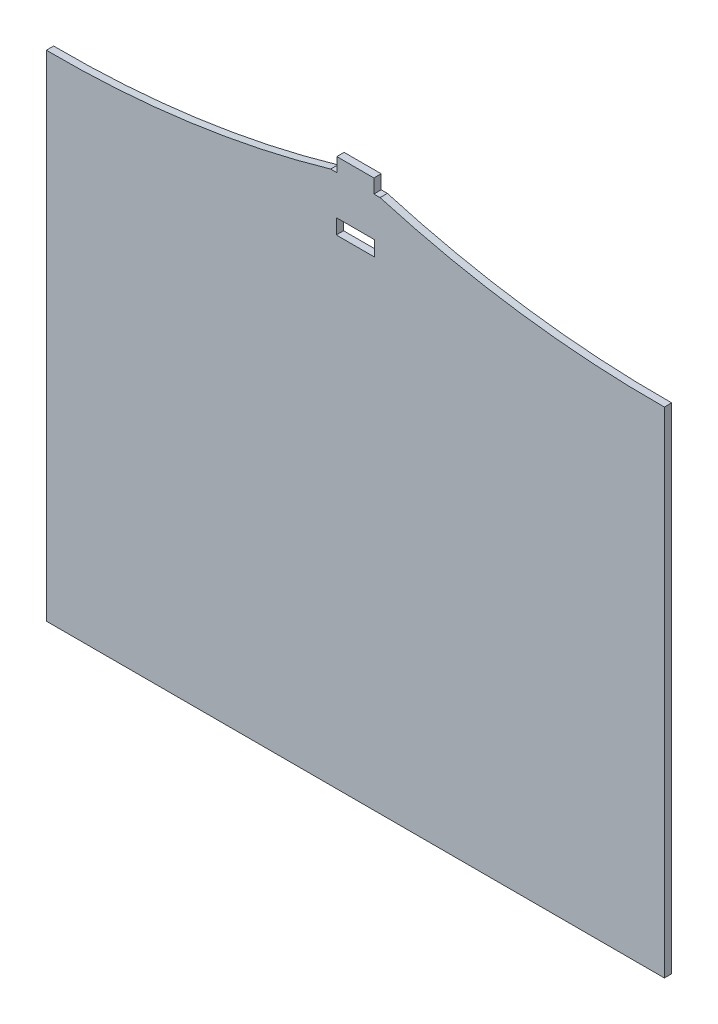
from build123d import *

# Parameters (mm, degrees)
SKETCH1_W           = 15.45
SKETCH1_H           = 6.08
BOSS_EXTRUDE1_DEPTH = 2.95


with BuildPart() as part:
    # Sketch1 → Boss-Extrude1 (new body)
    with BuildSketch(Plane.XY):
        with BuildLine():
            Line((0.171167624, 69.469671818), (2.671167624, 69.469671818))
            Line((2.671167624, 69.469671818), (2.671167624, 75.099671818))
            Line((2.671167624, 75.099671818), (17.671167624, 75.099671818))
            Line((17.671167624, 75.099671818), (17.671167624, 69.469671818))
            Line((17.671167624, 69.469671818), (20.171167624, 69.469671818))
            ThreePointArc((20.171167624, 69.469671818), (77.092371221, 57.340494982), (135.171167624, 53.599671818))
            Line((135.171167624, 53.599671818), (135.171167624, -146.400328182))
            Line((135.171167624, -146.400328182), (-114.828832376, -146.400328182))
            Line((-114.828832376, -146.400328182), (-114.828832376, 53.599671818))
            ThreePointArc((-114.828832376, 53.599671818), (-56.750035973, 57.340494982), (0.171167624, 69.469671818))
        make_face()
        with Locations((10.171167624, 50.559671818)):
            Rectangle(SKETCH1_W, SKETCH1_H, mode=Mode.SUBTRACT)
    extrude(amount=BOSS_EXTRUDE1_DEPTH)


solid = part.part
